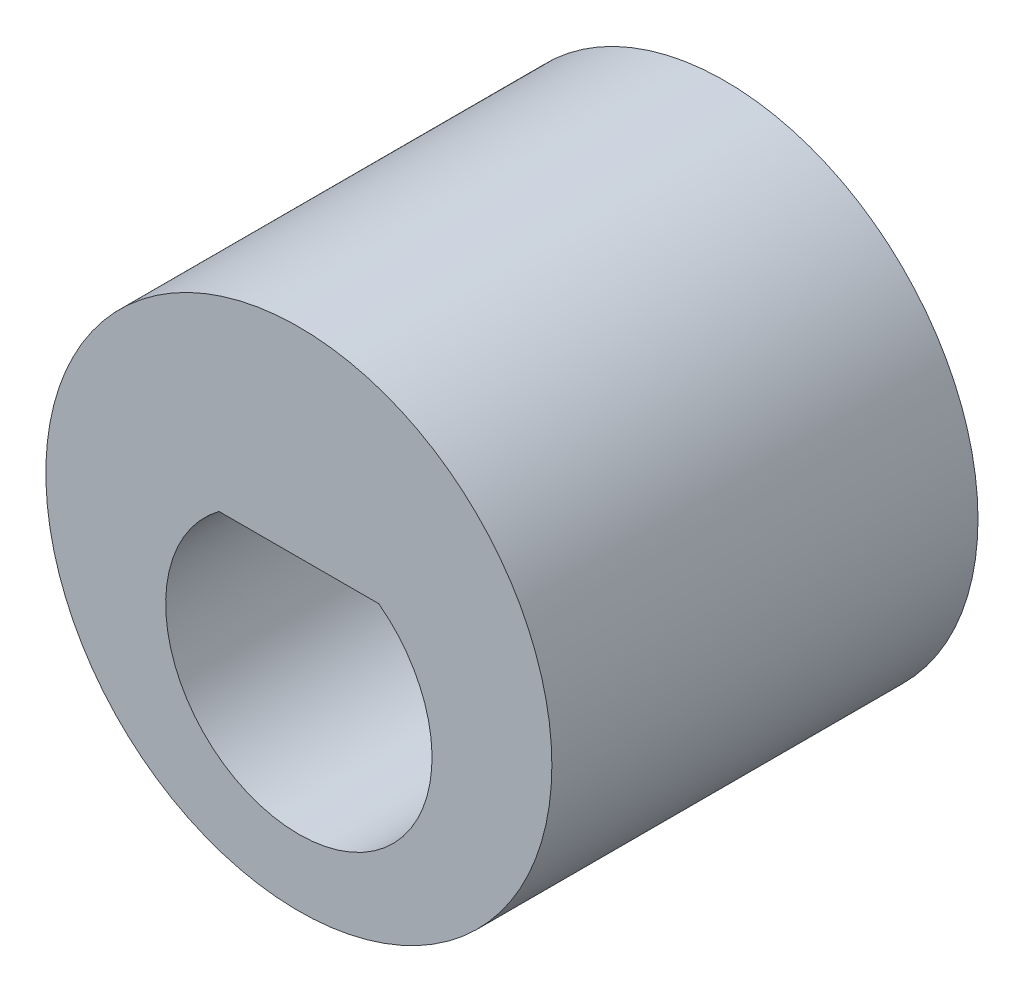
from build123d import *

# Parameters (mm, degrees)
ESQUISSE1_R        = 4.75
BOSS_EXTRU_1_DEPTH = 8


with BuildPart() as part:
    # Esquisse1 → Boss.-Extru.1 (new body)
    with BuildSketch(Plane.XY):
        with Locations((0, 1)):
            Circle(ESQUISSE1_R)
        with BuildLine():
            Line((-1.5, 2), (1.5, 2))
            ThreePointArc((1.5, 2), (0, -2.5), (-1.5, 2))
        make_face(mode=Mode.SUBTRACT)
    extrude(amount=BOSS_EXTRU_1_DEPTH)


solid = part.part
